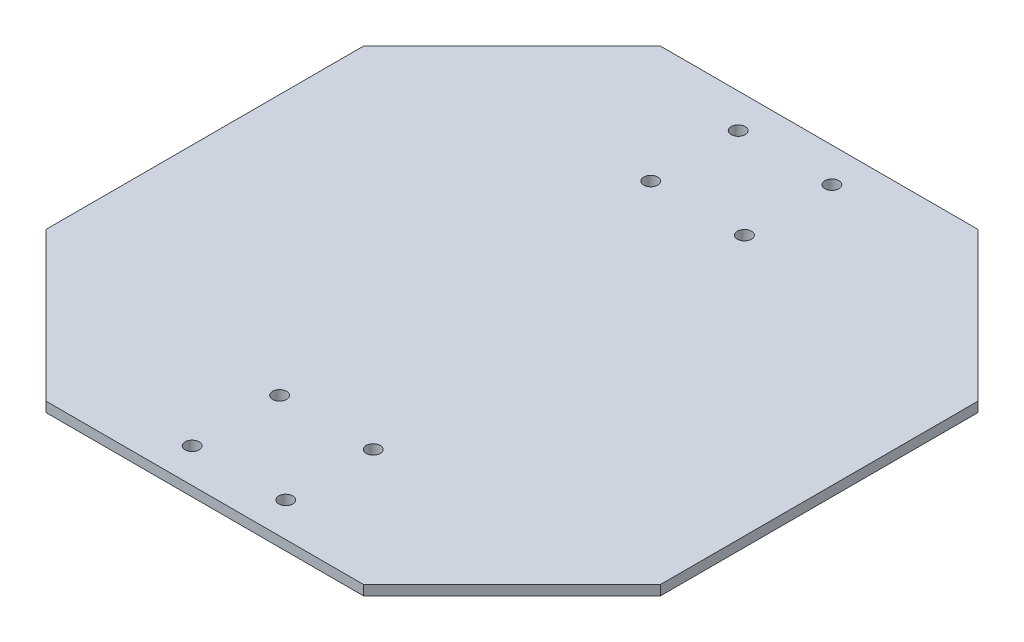
from build123d import *

# Parameters (mm, degrees)
BOSS_EXTRUDE1_DEPTH  = 3.175
M4_CLEARANCE_HOLE1_D = 4.5


with BuildPart() as part:
    # Sketch1 → Boss-Extrude1 (new body)
    with BuildSketch(Plane(origin=(0, 0, 0), x_dir=(1, 0, 0), z_dir=(0, 1, 0))):
        Polygon((-98.425, 50.8), (-50.8, 98.425), (50.8, 98.425), (98.425, 50.8), (98.425, -50.8), (50.8, -98.425), (-50.8, -98.425), (-98.425, -50.8), align=None)
    extrude(amount=BOSS_EXTRUDE1_DEPTH)

    # M4 Clearance Hole1 (through all)
    with Locations(Plane(origin=(-15, 3.175, -87.425), x_dir=(0, 0, 1), z_dir=(0, 1, 0))):
        with Locations((0, 0), (28, 0), (28, 30), (0, 30)):
            m4_clearance_hole1 = Hole(M4_CLEARANCE_HOLE1_D / 2)

    # Mirror1: M4 Clearance Hole1 across plane
    add(m4_clearance_hole1.mirror(Plane.XY), mode=Mode.SUBTRACT)


solid = part.part
